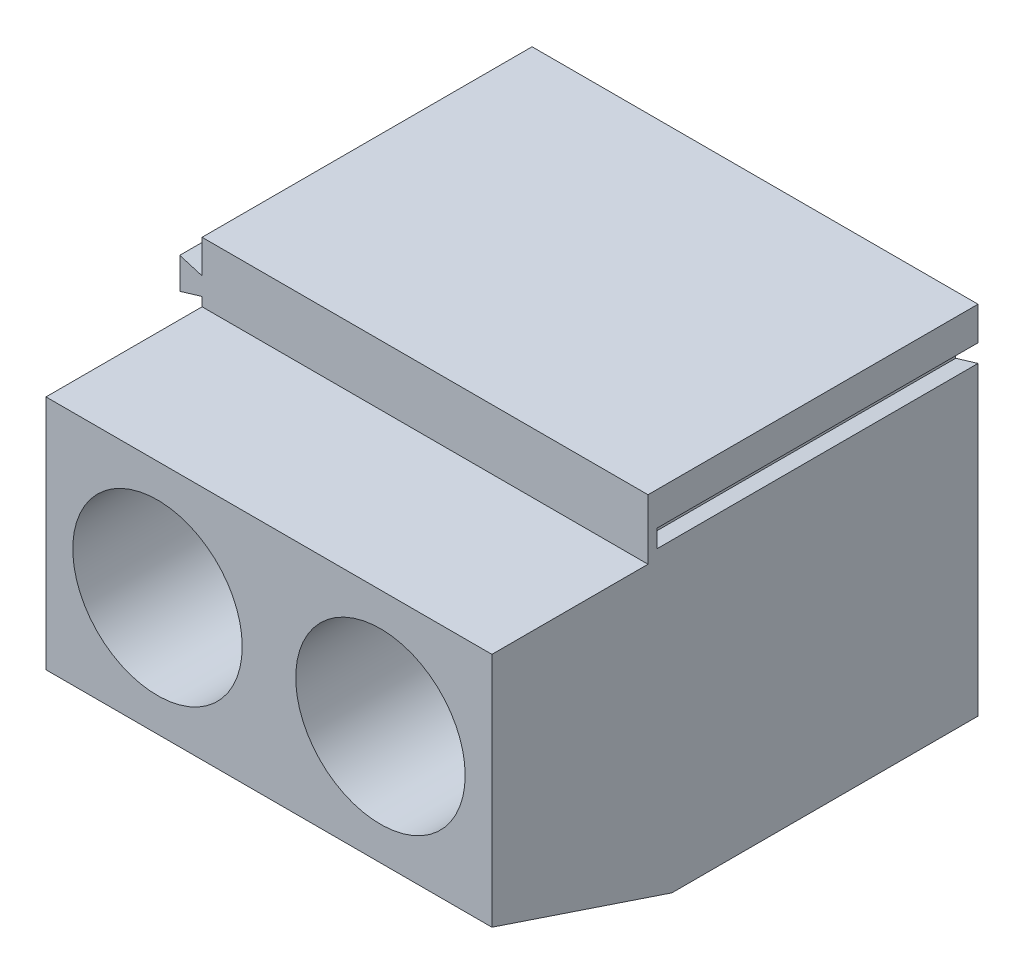
from build123d import *

# Parameters (mm, degrees)
SKETCH1_W           = 10
SKETCH1_H           = 8
BOSS_EXTRUDE1_DEPTH = 10.9
CHAMFER1_SIZE       = 1.35
CHAMFER1_SIZE2      = 4.0347247
SKETCH2_W           = 10
SKETCH2_H           = 3.5
CUT_EXTRUDE1_DEPTH  = 1.35
SKETCH3_W           = 4
SKETCH3_H           = 5
CUT_EXTRUDE2_DEPTH  = 7
CHAMFER2_SIZE       = 1.2
CUT_EXTRUDE3_DEPTH  = 0.65
SKETCH5_R           = 1.9
CUT_EXTRUDE4_DEPTH  = 5.25
BOSS_EXTRUDE3_DEPTH = 7.4
CUT_EXTRUDE5_DEPTH  = 7.2


with BuildPart() as part:
    # Sketch1 → Boss-Extrude1 (new body)
    with BuildSketch(Plane.XY):
        Rectangle(SKETCH1_W, SKETCH1_H)
    extrude(amount=BOSS_EXTRUDE1_DEPTH)

    # Chamfer1
    chamfer1_edges = [part.edges().sort_by_distance(p)[0] for p in [
        (0, -4, 10.9),
    ]]
    chamfer1_side = [part.faces().sort_by_distance(p)[0] for p in [
        (0, 0, 10.9),
    ]]
    chamfer(chamfer1_edges, length=CHAMFER1_SIZE, length2=CHAMFER1_SIZE2, reference=chamfer1_side[0])

    # Sketch2 → Cut-Extrude1 (cut)
    with BuildSketch(Plane(origin=(0, 4, 0), x_dir=(1, 0, 0), z_dir=(0, 1, 0))):
        with Locations((0, -9.15)):
            Rectangle(SKETCH2_W, SKETCH2_H)
    extrude(amount=-CUT_EXTRUDE1_DEPTH, mode=Mode.SUBTRACT)

    # Sketch3 → Cut-Extrude2 (cut)
    with BuildSketch(Plane.XZ.offset(4)):
        with Locations((-2.475, 3.15)):
            Rectangle(SKETCH3_W, SKETCH3_H)
        with Locations((2.475, 3.15)):
            Rectangle(SKETCH3_W, SKETCH3_H)
    extrude(amount=-CUT_EXTRUDE2_DEPTH, mode=Mode.SUBTRACT)

    # Chamfer2
    chamfer2_edges = [part.edges().sort_by_distance(p)[0] for p in [
        (-2.475, -4, 5.65),
        (2.475, -4, 5.65),
    ]]
    chamfer(chamfer2_edges, length=CHAMFER2_SIZE)

    # Sketch4 → Cut-Extrude3 (cut)
    with BuildSketch(Plane(origin=(0, 0, 0), x_dir=(-1, 0, 0), z_dir=(0, 0, -1))):
        Polygon((2, 0.7), (3, 0.7), (3, -2.4), (3.25, -4), (1.75, -4), (2, -2.4), align=None)
        Polygon((-2, 0.7), (-2, -2.4), (-1.75, -4), (-3.25, -4), (-3, -2.4), (-3, 0.7), align=None)
    extrude(amount=-CUT_EXTRUDE3_DEPTH, mode=Mode.SUBTRACT)

    # Sketch5 → Cut-Extrude4 (cut)
    with BuildSketch(Plane.XY.offset(10.9)):
        with Locations((-2.5, 0)):
            Circle(SKETCH5_R)
        with Locations((2.5, 0)):
            Circle(SKETCH5_R)
    extrude(amount=-CUT_EXTRUDE4_DEPTH, mode=Mode.SUBTRACT)

    # Sketch6 → Boss-Extrude3 (add)
    with BuildSketch(Plane(origin=(0, 0, 0), x_dir=(-1, 0, 0), z_dir=(0, 0, -1))):
        Polygon((5, 3.25), (5, 2.85), (5.5, 2.7), (5.5, 3.4), align=None)
    extrude(amount=-BOSS_EXTRUDE3_DEPTH)

    # Sketch7 → Cut-Extrude5 (cut)
    with BuildSketch(Plane(origin=(0, 0, 0), x_dir=(-1, 0, 0), z_dir=(0, 0, -1))):
        Polygon((-5, 3.25), (-4.5, 3.4), (-4.5, 2.7), (-5, 2.85), align=None)
    extrude(amount=-CUT_EXTRUDE5_DEPTH, mode=Mode.SUBTRACT)


solid = part.part
